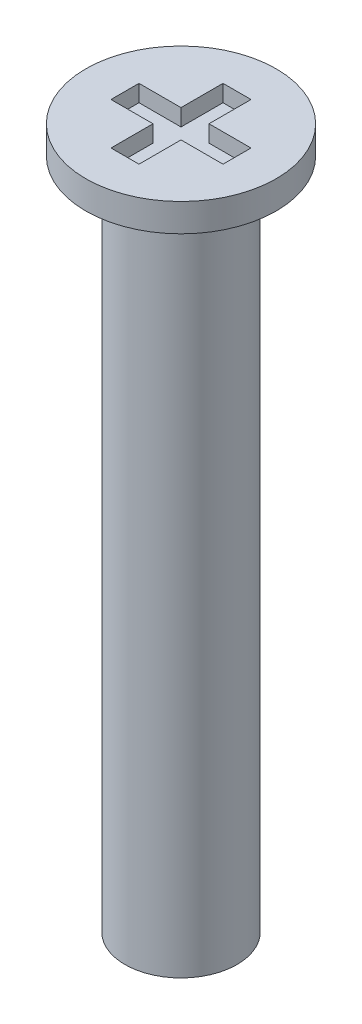
from build123d import *

# Parameters (mm, degrees)
SKETCH_2_W               = 0.5
SKETCH_2_H               = 1
CUT_EXTRUDE_1_DEPTH      = 0.3
PATTERN_CIRCULAR_1_COUNT = 4


with BuildPart() as part:
    # ｽｹｯﾁ1 → 回転1 (revolve)
    with BuildSketch(Plane.XY, mode=Mode.PRIVATE) as revolve_1_sk:
        Polygon((0, 0), (1.7, 0), (1.7, -0.5), (1, -0.5), (1, -12.5), (0, -12.5), align=None)
    revolve(revolve_1_sk.sketch.rotate(Axis((0, -12.5, 0), (0, 1, 0)), 90), axis=Axis((0, -12.5, 0), (0, 1, 0)))

    # ｽｹｯﾁ2 → ｶｯﾄ - 押し出し1 (cut)
    with BuildSketch(Plane(origin=(0, 0, 0), x_dir=(1, 0, 0), z_dir=(0, 1, 0))):
        with Locations((0, 0.5)):
            Rectangle(SKETCH_2_W, SKETCH_2_H)
    cut_extrude_1 = extrude(amount=-CUT_EXTRUDE_1_DEPTH, mode=Mode.SUBTRACT)

    # 円形ﾊﾟﾀｰﾝ1: ｶｯﾄ - 押し出し1 ×4 about axis
    pattern_circular_1_axis = Axis((0, 0, 0), (0, 1, 0))
    for i in range(1, PATTERN_CIRCULAR_1_COUNT):
        add(cut_extrude_1.rotate(pattern_circular_1_axis, i * 360 / PATTERN_CIRCULAR_1_COUNT), mode=Mode.SUBTRACT)


solid = part.part
